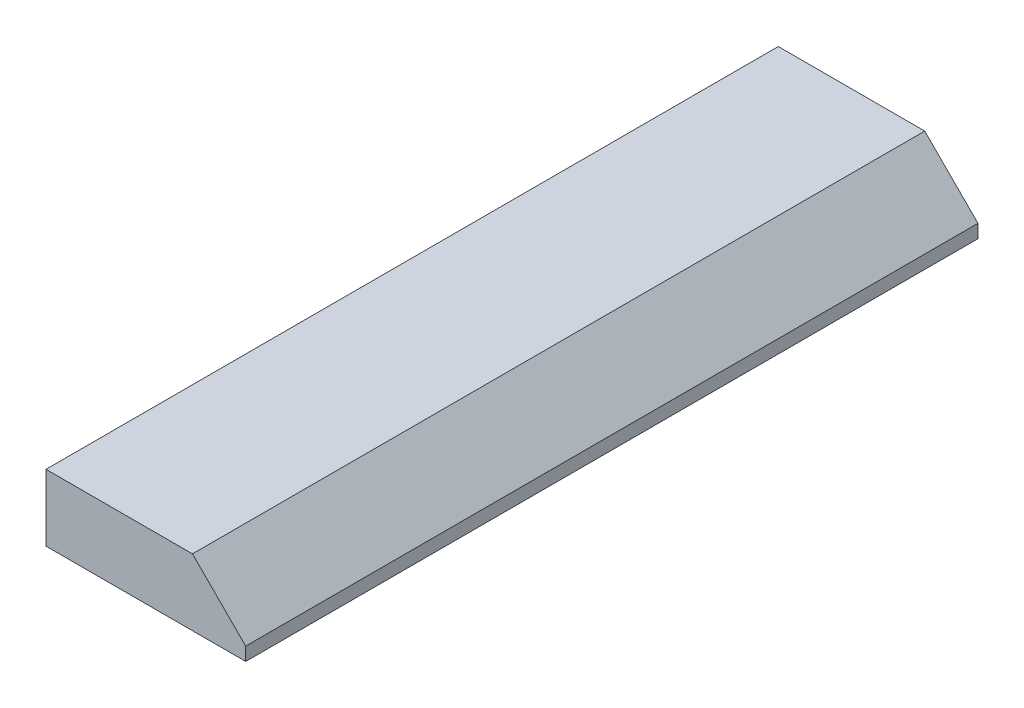
from build123d import *

# Parameters (mm, degrees)
BOSS_EXTRUDE1_DEPTH = 69.85


with BuildPart() as part:
    # Sketch1 → Boss-Extrude1 (new body)
    with BuildSketch(Plane.XY):
        Polygon((19.05, 1.27), (13.97, 6.35), (0, 6.35), (0, 0), (19.05, 0), align=None)
    extrude(amount=BOSS_EXTRUDE1_DEPTH)


solid = part.part
